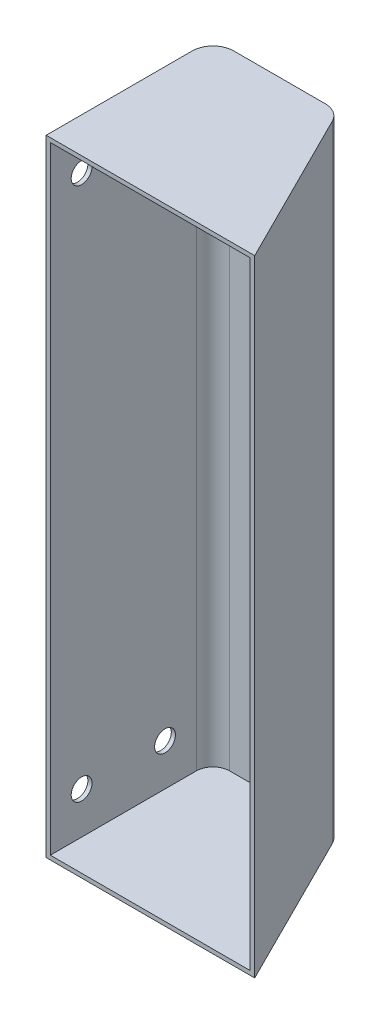
from build123d import *

# Parameters (mm, degrees)
BOSS_EXTRUDE1_DEPTH = 75
SHELL1_T            = -1
CUT_EXTRUDE1_REACH  = 100.112
SKETCH3_R           = 2.5


with BuildPart() as part:
    # Sketch2 → Boss-Extrude1 (new, symmetric)
    with BuildSketch(Plane(origin=(0, 0, 0), x_dir=(-1, 0, 0), z_dir=(0, 1, 0))):
        with BuildLine():
            Line((0, 40), (0, 5))
            ThreePointArc((0, 5), (-1.464466094, 1.464466094), (-5, 0))
            Line((-5, 0), (-26.909830056, 0))
            ThreePointArc((-26.909830056, 0), (-29.538485617, 0.746745958), (-31.381966011, 2.763932023))
            Line((-31.381966011, 2.763932023), (-50, 40))
            Line((-50, 40), (0, 40))
        make_face()
    extrude(amount=BOSS_EXTRUDE1_DEPTH, both=True)

    # Shell1
    shell1_openings = [part.faces().sort_by_distance(p)[0] for p in [
        (25, 0, 40),
    ]]
    offset(amount=SHELL1_T, openings=shell1_openings, kind=Kind.INTERSECTION)

    # Sketch3 → Cut-Extrude1 (cut, up to next)
    with BuildSketch(Plane.YZ.offset(1), mode=Mode.PRIVATE) as cut_extrude1_sk1:
        with Locations(Location((-64, 32.5, 0), (0, 0, 270))):
            Circle(SKETCH3_R)
    cut_extrude1_tool1 = extrude(cut_extrude1_sk1.sketch, amount=-CUT_EXTRUDE1_REACH, mode=Mode.PRIVATE) & part.part
    # Sketch3 → Cut-Extrude1 (cut, up to next)
    with BuildSketch(Plane.YZ.offset(1), mode=Mode.PRIVATE) as cut_extrude1_sk2:
        with Locations(Location((-64, 12.5, 0), (0, 0, 270))):
            Circle(SKETCH3_R)
    cut_extrude1_tool2 = extrude(cut_extrude1_sk2.sketch, amount=-CUT_EXTRUDE1_REACH, mode=Mode.PRIVATE) & part.part
    # Sketch3 → Cut-Extrude1 (cut, up to next)
    with BuildSketch(Plane.YZ.offset(1), mode=Mode.PRIVATE) as cut_extrude1_sk3:
        with Locations(Location((64, 12.5, 0), (0, 0, 270))):
            Circle(SKETCH3_R)
    cut_extrude1_tool3 = extrude(cut_extrude1_sk3.sketch, amount=-CUT_EXTRUDE1_REACH, mode=Mode.PRIVATE) & part.part
    # Sketch3 → Cut-Extrude1 (cut, up to next)
    with BuildSketch(Plane.YZ.offset(1), mode=Mode.PRIVATE) as cut_extrude1_sk4:
        with Locations(Location((64, 32.5, 0), (0, 0, 270))):
            Circle(SKETCH3_R)
    cut_extrude1_tool4 = extrude(cut_extrude1_sk4.sketch, amount=-CUT_EXTRUDE1_REACH, mode=Mode.PRIVATE) & part.part
    add(cut_extrude1_tool1.solids().sort_by_distance((1, -64, 32.5))[0], mode=Mode.SUBTRACT)
    add(cut_extrude1_tool2.solids().sort_by_distance((1, -64, 12.5))[0], mode=Mode.SUBTRACT)
    add(cut_extrude1_tool3.solids().sort_by_distance((1, 64, 12.5))[0], mode=Mode.SUBTRACT)
    add(cut_extrude1_tool4.solids().sort_by_distance((1, 64, 32.5))[0], mode=Mode.SUBTRACT)


solid = part.part
